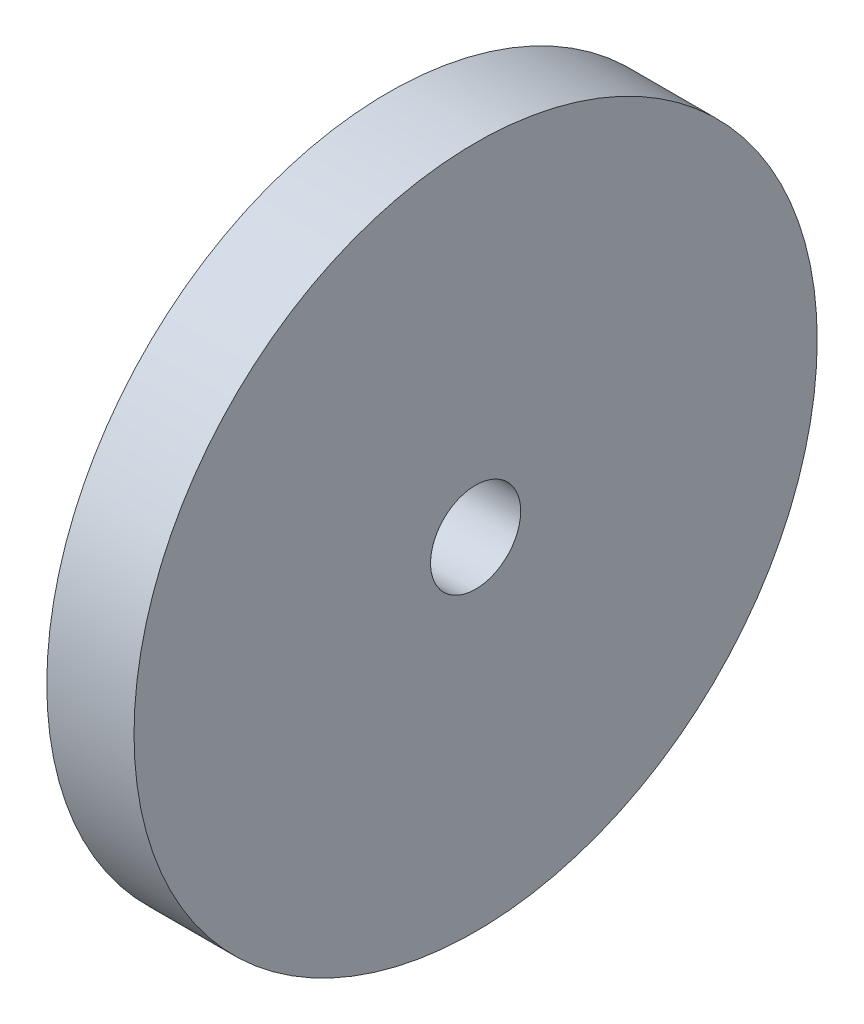
from build123d import *

# Parameters (mm, degrees)
SKETCH1_R           = 11.75
SKETCH1_R_2         = 1.55
BOSS_EXTRUDE1_DEPTH = 3


with BuildPart() as part:
    # Sketch1 → Boss-Extrude1 (new body)
    with BuildSketch(Plane(origin=(0, 0, 0), x_dir=(0, 0, -1), z_dir=(1, 0, 0))):
        Circle(SKETCH1_R)
        Circle(SKETCH1_R_2, mode=Mode.SUBTRACT)
    extrude(amount=BOSS_EXTRUDE1_DEPTH)


solid = part.part
